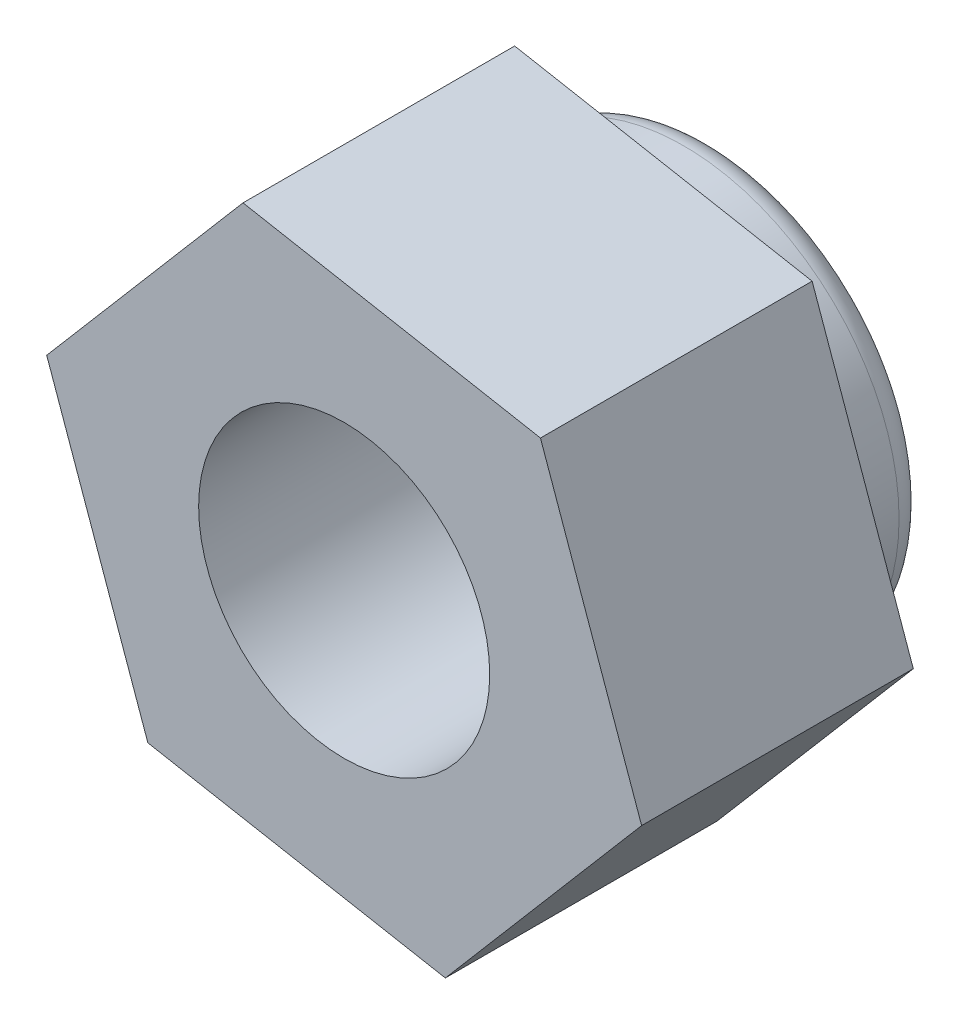
from build123d import *

# Parameters (mm, degrees)
SKETCH_1_R          = 1.5
EXTRUDE_1_DEPTH     = 3.8
SKETCH_2_OUTSIDE_W  = 9.992
SKETCH_2_OUTSIDE_H  = 9.736
SKETCH_2_OUTSIDE_R  = 2.219238474
CUT_EXTRUDE_1_DEPTH = 1
FILLET_1_R          = 0.3


with BuildPart() as part:
    # 草图1 → 凸台-拉伸1 (new body)
    with BuildSketch(Plane.XY):
        Polygon((-1.042677443, 2.938166733), (-3.065865753, 0.566098213), (-2.02318831, -2.37206852), (1.042677443, -2.938166733), (3.065865753, -0.566098213), (2.02318831, 2.37206852), align=None)
        with Locations(Location((0, 0, 0), (0, 0, 180))):
            Circle(SKETCH_1_R, mode=Mode.SUBTRACT)
    extrude(amount=EXTRUDE_1_DEPTH)

    # 草图2 outside → 切除-拉伸1 (cut)
    with BuildSketch(Plane(origin=(0, 0, 0), x_dir=(-1, 0, 0), z_dir=(0, 0, -1))):
        Rectangle(SKETCH_2_OUTSIDE_W, SKETCH_2_OUTSIDE_H)
        Circle(SKETCH_2_OUTSIDE_R, mode=Mode.SUBTRACT)
    extrude(amount=-CUT_EXTRUDE_1_DEPTH, mode=Mode.SUBTRACT)

    # 圆角1
    fillet_1_edges = [part.edges().sort_by_distance(p)[0] for p in [
        (2.219238474, 0, 0),
    ]]
    fillet(fillet_1_edges, radius=FILLET_1_R)


solid = part.part
